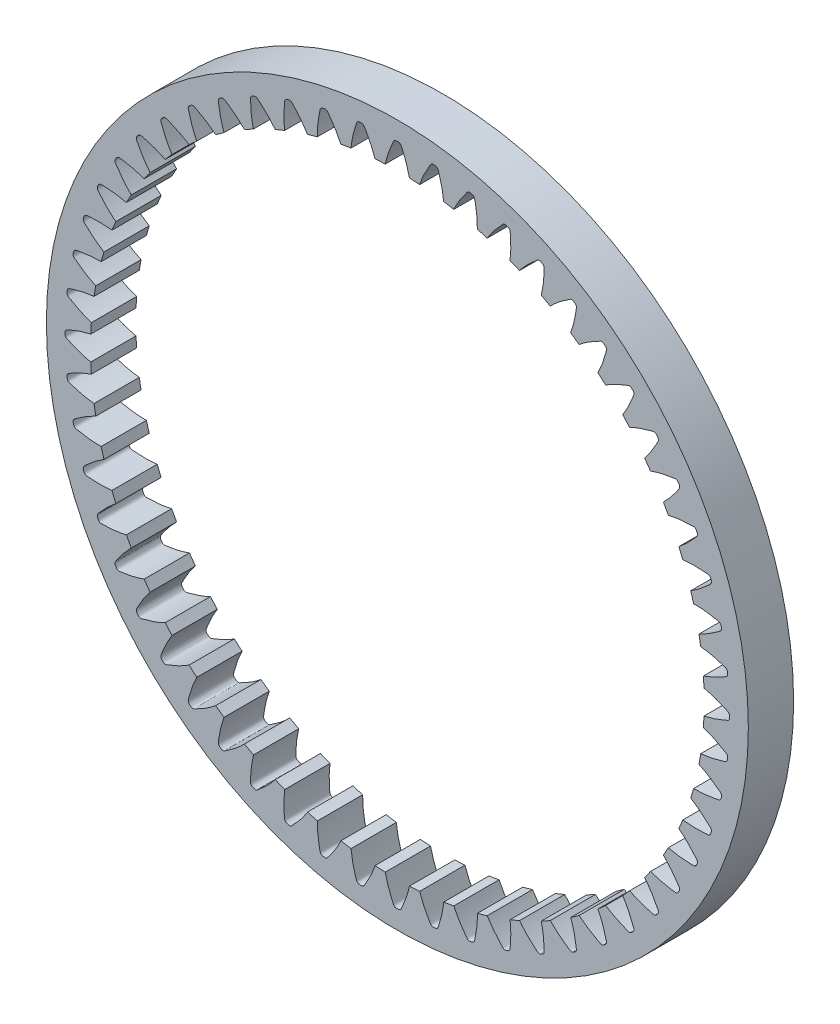
from build123d import *

# Parameters (mm, degrees)
SKETCHREVOLVESPURGEAR_W       = 4
SKETCHREVOLVESPURGEAR_H       = 3.899999984
TOOTHEXTRUDECUTSPURGEAR_DEPTH = 2
PATTERNSPURGEAR_COUNT         = 56


with BuildPart() as part:
    # SketchRevolveSpurGear → SpurGear (revolve)
    with BuildSketch(Plane(origin=(0, 0, 0), x_dir=(0, 0, -1), z_dir=(1, 0, 0))):
        with Locations((0, 29.049999587)):
            Rectangle(SKETCHREVOLVESPURGEAR_W, SKETCHREVOLVESPURGEAR_H)
    revolve(axis=Axis((0, 0, 0), (0, 0, -1)))

    # SketchToothSpurGear → ToothExtrudeCutSpurGear (cut, symmetric)
    with BuildSketch(Plane.XY):
        with BuildLine():
            ThreePointArc((27.063332087, -1.071370556), (27.084530244, 0), (27.063332087, 1.071370556))
            add(Edge.make_bspline(
                [(27.063332087, 1.071370556), (27.171573209, 1.049425063), (27.340178009, 1.010760233), (27.572453411, 0.9491714), (27.766492752, 0.892812808), (27.973028616, 0.827518082), (28.191758291, 0.752710064), (28.422267464, 0.667618608), (28.664485565, 0.57231675), (28.916836587, 0.463509095), (29.103813831, 0.385091203), (29.21503382, 0.326877697), (29.249157953, 0.300423151), (29.27903849, 0.270103429), (29.304300362, 0.235787623), (29.324430622, 0.198260077), (29.343972571, 0.145534595), (29.350704911, 0.090734704), (29.349827769, 0.037837753), (29.350085457, 0), (29.349827769, -0.037837753), (29.350704911, -0.090734704), (29.343972571, -0.145534595), (29.324430622, -0.198260077), (29.304300362, -0.235787623), (29.27903849, -0.270103429), (29.249157953, -0.300423151), (29.21503382, -0.326877697), (29.103813831, -0.385091203), (28.916836587, -0.463509095), (28.664485565, -0.57231675), (28.422267464, -0.667618608), (28.191758291, -0.752710064), (27.973028616, -0.827518082), (27.766492752, -0.892812808), (27.572453411, -0.9491714), (27.340178009, -1.010760233), (27.171573209, -1.049425063), (27.063332087, -1.071370556)],
                knots=[0, 0, 0, 0, 0.062422985, 0.0977473, 0.135813497, 0.176621576, 0.220171537, 0.26646338, 0.315497105, 0.367272711, 0.4217902, 0.4300799, 0.438078932, 0.446077965, 0.454076997, 0.46207603, 0.470075062, 0.485744467, 0.492872239, 0.5, 0.507127761, 0.514255533, 0.529924938, 0.53792397, 0.545923003, 0.553922035, 0.561921068, 0.5699201, 0.5782098, 0.632727289, 0.684502895, 0.73353662, 0.779828463, 0.823378424, 0.864186503, 0.9022527, 0.937577015, 1, 1, 1, 1], degree=3))
        make_face()
    toothextrudecutspurgear = extrude(amount=TOOTHEXTRUDECUTSPURGEAR_DEPTH, both=True, mode=Mode.SUBTRACT)

    # PatternSpurGear: ToothExtrudeCutSpurGear ×56 about axis
    patternspurgear_axis = Axis((0, 0, 55), (0, 0, -1))
    for i in range(1, PATTERNSPURGEAR_COUNT):
        add(toothextrudecutspurgear.rotate(patternspurgear_axis, i * 360 / PATTERNSPURGEAR_COUNT), mode=Mode.SUBTRACT)


solid = part.part
